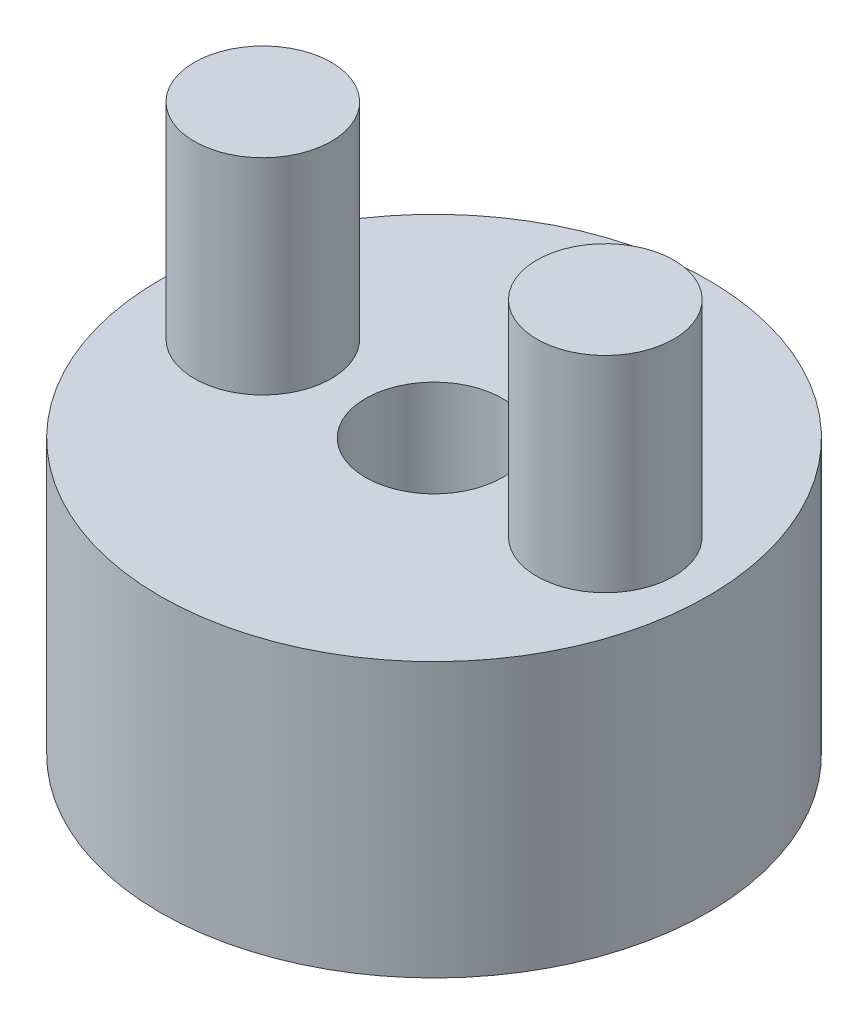
from build123d import *

# Parameters (mm, degrees)
SKETCH1_R                    = 6.35
BOSS_EXTRUDE1_DEPTH          = 6.35
F_1_8_0_125_DIAMETER_HOLE1_D = 3.175
SKETCH4_R                    = 1.5875
BOSS_EXTRUDE2_DEPTH          = 4.7625


with BuildPart() as part:
    # Sketch1 → Boss-Extrude1 (new body)
    with BuildSketch(Plane(origin=(0, 0, 0), x_dir=(1, 0, 0), z_dir=(0, 1, 0))):
        with Locations(Location((0, 0, 0), (0, 0, 270))):
            Circle(SKETCH1_R)
    extrude(amount=BOSS_EXTRUDE1_DEPTH)

    # 1/8 (0.125) Diameter Hole1 (through all)
    with Locations(Plane(origin=(0, 6.35, 0), x_dir=(1, 0, 0), z_dir=(0, 1, 0))):
        with Locations((0, 0)):
            Hole(F_1_8_0_125_DIAMETER_HOLE1_D / 2)

    # Sketch4 → Boss-Extrude2 (add)
    with BuildSketch(Plane(origin=(0, 6.35, 0), x_dir=(1, 0, 0), z_dir=(0, 1, 0))):
        with Locations(Location((3.96875, 0, 0), (0, 0, 90))):
            Circle(SKETCH4_R)
        with Locations(Location((-3.96875, 0, 0), (0, 0, 90))):
            Circle(SKETCH4_R)
    extrude(amount=BOSS_EXTRUDE2_DEPTH)


solid = part.part
